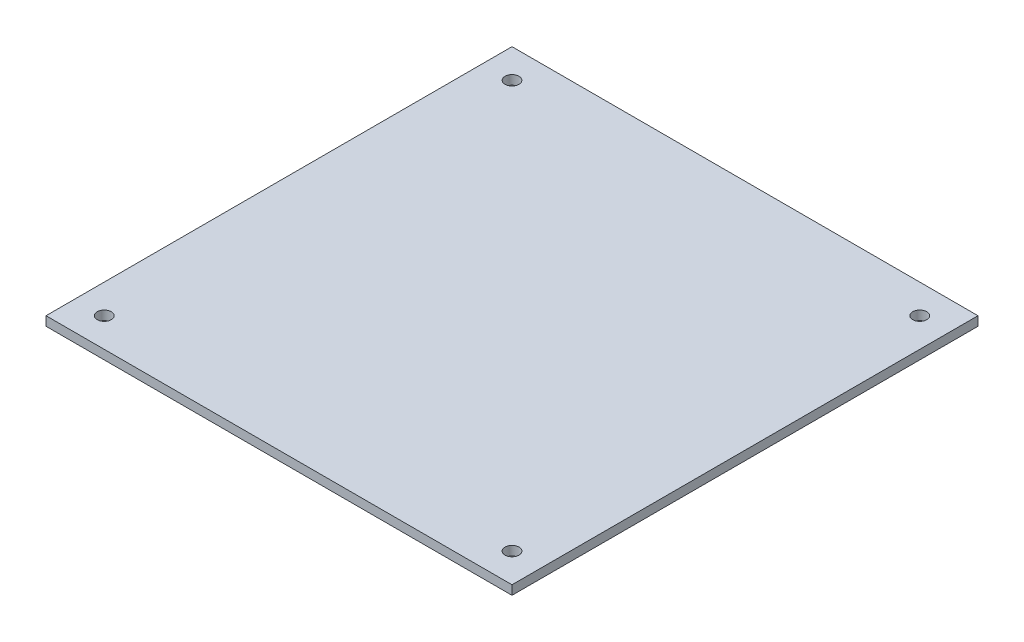
from build123d import *

# Parameters (mm, degrees)
SKETCH1_W           = 101.6
SKETCH1_H           = 101.6
BOSS_EXTRUDE1_DEPTH = 2
SKETCH3_R           = 1.524
CUT_EXTRUDE1_DEPTH  = 72.869882427


with BuildPart() as part:
    # Sketch1 → Boss-Extrude1 (new body)
    with BuildSketch(Plane(origin=(0, 0, 0), x_dir=(1, 0, 0), z_dir=(0, 1, 0))):
        Rectangle(SKETCH1_W, SKETCH1_H)
    extrude(amount=BOSS_EXTRUDE1_DEPTH)

    # Sketch3 → Cut-Extrude1 (cut, through all)
    with BuildSketch(Plane(origin=(0, 2, 0), x_dir=(1, 0, 0), z_dir=(0, 1, 0))):
        with Locations(Location((-44.45, -44.45, 0), (0, 0, 270))):
            Circle(SKETCH3_R)
        with Locations(Location((44.45, -44.45, 0), (0, 0, 270))):
            Circle(SKETCH3_R)
        with Locations(Location((44.45, 44.45, 0), (0, 0, 270))):
            Circle(SKETCH3_R)
        with Locations(Location((-44.45, 44.45, 0), (0, 0, 270))):
            Circle(SKETCH3_R)
    extrude(amount=-CUT_EXTRUDE1_DEPTH, mode=Mode.SUBTRACT)


solid = part.part
